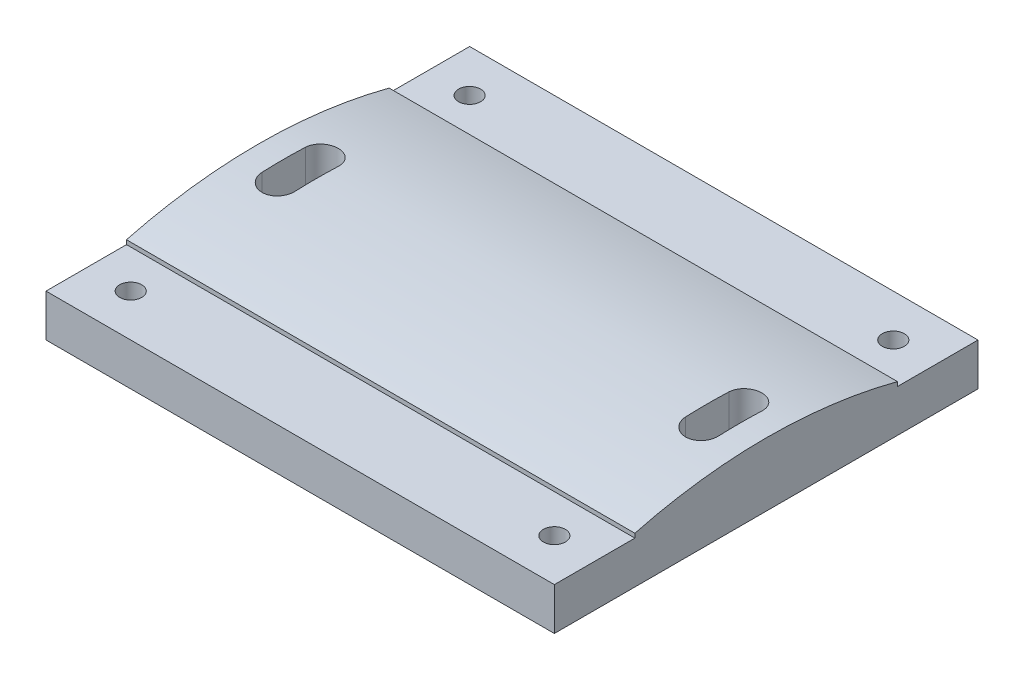
from build123d import *

# Parameters (mm, degrees)
SKETCH_1_W             = 600
SKETCH_1_H             = 500
EXTRUDE_1_DEPTH        = 75
CUT_EXTRUDE_1_DEPTH    = 785.617741324
CUT_EXTRUDE_2_DEPTH    = 785.617741324
SKETCH_5_R             = 13
CUT_EXTRUDE_3_DEPTH    = 783.623792125
CUT_EXTRUDE_4_DEPTH    = 785.617741324
PATTERN_LINEAR_1_COUNT = 2
PATTERN_LINEAR_1_PITCH = 500


with BuildPart() as part:
    # 草图1 → 凸台-拉伸1 (new body)
    with BuildSketch(Plane(origin=(0, 0, 0), x_dir=(1, 0, 0), z_dir=(0, 1, 0))):
        with Locations((300, 250)):
            Rectangle(SKETCH_1_W, SKETCH_1_H)
    extrude(amount=EXTRUDE_1_DEPTH)

    # 草图3 → 切除-拉伸1 (cut, through all)
    with BuildSketch(Plane(origin=(600, 0, 0), x_dir=(0, 0, -1), z_dir=(1, 0, 0))):
        with BuildLine():
            Line((405, 55), (405, 50))
            Line((405, 50), (500, 50))
            Line((500, 50), (500, 75))
            Line((500, 75), (250, 75))
            ThreePointArc((250, 75), (328.14249804, 69.979359813), (405, 55))
        make_face()
    extrude(amount=-CUT_EXTRUDE_1_DEPTH, mode=Mode.SUBTRACT)

    # 草图4 → 切除-拉伸2 (cut, through all)
    with BuildSketch(Plane(origin=(600, 0, 0), x_dir=(0, 0, -1), z_dir=(1, 0, 0))):
        with BuildLine():
            Line((0, 75), (0, 50))
            Line((0, 50), (95, 50))
            Line((95, 50), (95, 55))
            ThreePointArc((95, 55), (171.85750196, 69.979359813), (250, 75))
            Line((250, 75), (0, 75))
        make_face()
    extrude(amount=-CUT_EXTRUDE_2_DEPTH, mode=Mode.SUBTRACT)

    # 草图5 → 切除-拉伸3 (cut, through all)
    with BuildSketch(Plane(origin=(0, 50, 0), x_dir=(1, 0, 0), z_dir=(0, 1, 0))):
        with Locations(Location((50, 450, 0), (0, 0, 270))):
            Circle(SKETCH_5_R)
        with Locations(Location((550, 450, 0), (0, 0, 270))):
            Circle(SKETCH_5_R)
        with Locations(Location((50, 50, 0), (0, 0, 270))):
            Circle(SKETCH_5_R)
        with Locations(Location((550, 50, 0), (0, 0, 270))):
            Circle(SKETCH_5_R)
    extrude(amount=-CUT_EXTRUDE_3_DEPTH, mode=Mode.SUBTRACT)

    # 草图6 → 切除-拉伸4 (cut, through all)
    with BuildSketch(Plane.XZ):
        with BuildLine():
            Line((30.5, -224.5), (30.5, -275.5))
            ThreePointArc((30.5, -275.5), (50, -295), (69.5, -275.5))
            Line((69.5, -275.5), (69.5, -224.5))
            ThreePointArc((69.5, -224.5), (50, -205), (30.5, -224.5))
        make_face()
    cut_extrude_4 = extrude(amount=-CUT_EXTRUDE_4_DEPTH, mode=Mode.SUBTRACT)

    # 阵列(线性)1: 切除-拉伸4 ×2
    with Locations(*[(i * PATTERN_LINEAR_1_PITCH, 0, 0) for i in range(1, PATTERN_LINEAR_1_COUNT)]):
        add(cut_extrude_4, mode=Mode.SUBTRACT)


solid = part.part
